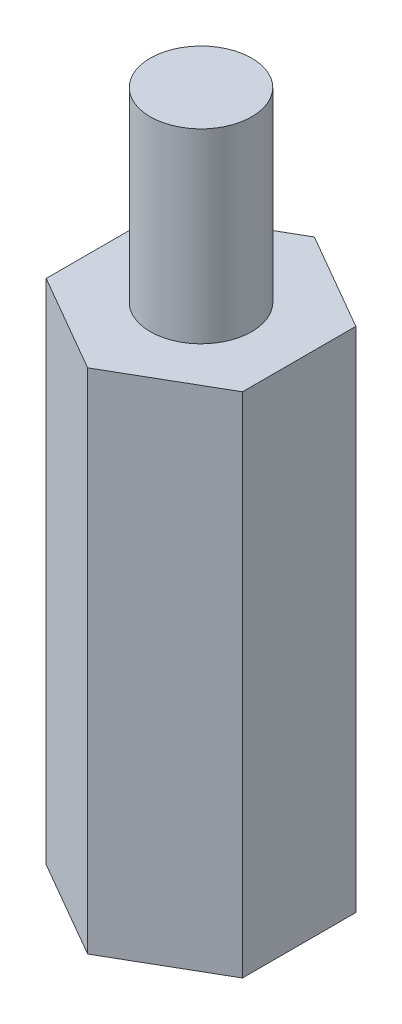
from build123d import *

# Parameters (mm, degrees)
SKETCH1_R           = 1.5
BOSS_EXTRUDE1_DEPTH = 7.5
SKETCH2_R           = 1.5
BOSS_EXTRUDE2_DEPTH = 5.5


with BuildPart() as part:
    # Sketch1 → Boss-Extrude1 (new, symmetric)
    with BuildSketch(Plane(origin=(0, 0, 0), x_dir=(1, 0, 0), z_dir=(0, 1, 0))):
        Polygon((0, -3.348631561), (2.9, -1.674315781), (2.9, 1.674315781), (0, 3.348631561), (-2.9, 1.674315781), (-2.9, -1.674315781), align=None)
        with Locations(Location((0, 0, 0), (0, 0, 270))):
            Circle(SKETCH1_R, mode=Mode.SUBTRACT)
    extrude(amount=BOSS_EXTRUDE1_DEPTH, both=True)


with BuildPart() as body_2:
    # Sketch2 → Boss-Extrude2 (new body)
    with BuildSketch(Plane(origin=(0, 7.5, 0), x_dir=(1, 0, 0), z_dir=(0, 1, 0))):
        with Locations(Location((0, 0, 0), (0, 0, 270))):
            Circle(SKETCH2_R)
    extrude(amount=BOSS_EXTRUDE2_DEPTH)


solid = Compound([part.part, body_2.part])
